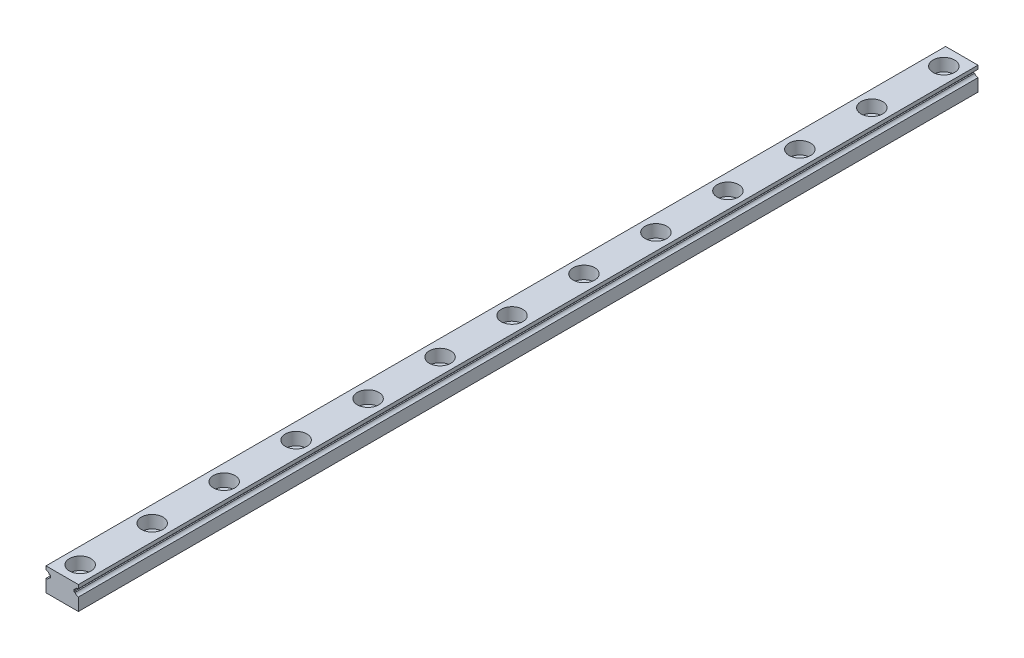
from build123d import *

# Parameters (mm, degrees)
EXTRUDE1_DEPTH  = 250
SKETCH2_R       = 3
EXTRUDE2_DEPTH  = 3.5
SKETCH_R        = 1.75
EXTRUDE3_DEPTH  = 251.124968766
LPATTERN1_COUNT = 13
LPATTERN1_PITCH = 20


with BuildPart() as part:
    # Sketch1 → Extrude1 (new body)
    with BuildSketch(Plane.XY):
        with BuildLine():
            Line((-4.5, -3.25), (4.5, -3.25))
            Line((4.5, -3.25), (4.5, 0.25))
            ThreePointArc((4.5, 0.25), (3.93077967, 0.427814974), (3.563991137, 0.898023568))
            Line((3.563991137, 0.898023568), (3.235073025, 0.898023568))
            Line((3.235073025, 0.898023568), (3.235073025, 1.601976432))
            Line((3.235073025, 1.601976432), (3.563991137, 1.601976432))
            ThreePointArc((3.563991137, 1.601976432), (3.93077967, 2.072185026), (4.5, 2.25))
            Line((4.5, 2.25), (4.5, 3.25))
            Line((4.5, 3.25), (-4.5, 3.25))
            Line((-4.5, 3.25), (-4.5, 2.25))
            ThreePointArc((-4.5, 2.25), (-3.93077967, 2.072185026), (-3.563991137, 1.601976432))
            Line((-3.563991137, 1.601976432), (-3.235073025, 1.601976432))
            Line((-3.235073025, 1.601976432), (-3.235073025, 0.898023568))
            Line((-3.235073025, 0.898023568), (-3.563991137, 0.898023568))
            ThreePointArc((-3.563991137, 0.898023568), (-3.93077967, 0.427814974), (-4.5, 0.25))
            Line((-4.5, 0.25), (-4.5, -3.25))
        make_face()
    extrude(amount=EXTRUDE1_DEPTH)

    # Sketch2 → Extrude2 (cut)
    with BuildSketch(Plane(origin=(0, 3.25, 0), x_dir=(1, 0, 0), z_dir=(0, 1, 0))):
        with Locations((0, -5)):
            Circle(SKETCH2_R)
    extrude2 = extrude(amount=-EXTRUDE2_DEPTH, mode=Mode.SUBTRACT)

    # Sketch → Extrude3 (cut, through all)
    with BuildSketch(Plane(origin=(0, 3.25, 0), x_dir=(1, 0, 0), z_dir=(0, 1, 0))):
        with Locations((0, -5)):
            Circle(SKETCH_R)
    extrude3 = extrude(amount=-EXTRUDE3_DEPTH, mode=Mode.SUBTRACT)

    # LPattern1: Extrude2, Extrude3 ×13
    with Locations(*[(0, 0, i * LPATTERN1_PITCH) for i in range(1, LPATTERN1_COUNT)]):
        add(extrude2, mode=Mode.SUBTRACT)
        add(extrude3, mode=Mode.SUBTRACT)


solid = part.part
